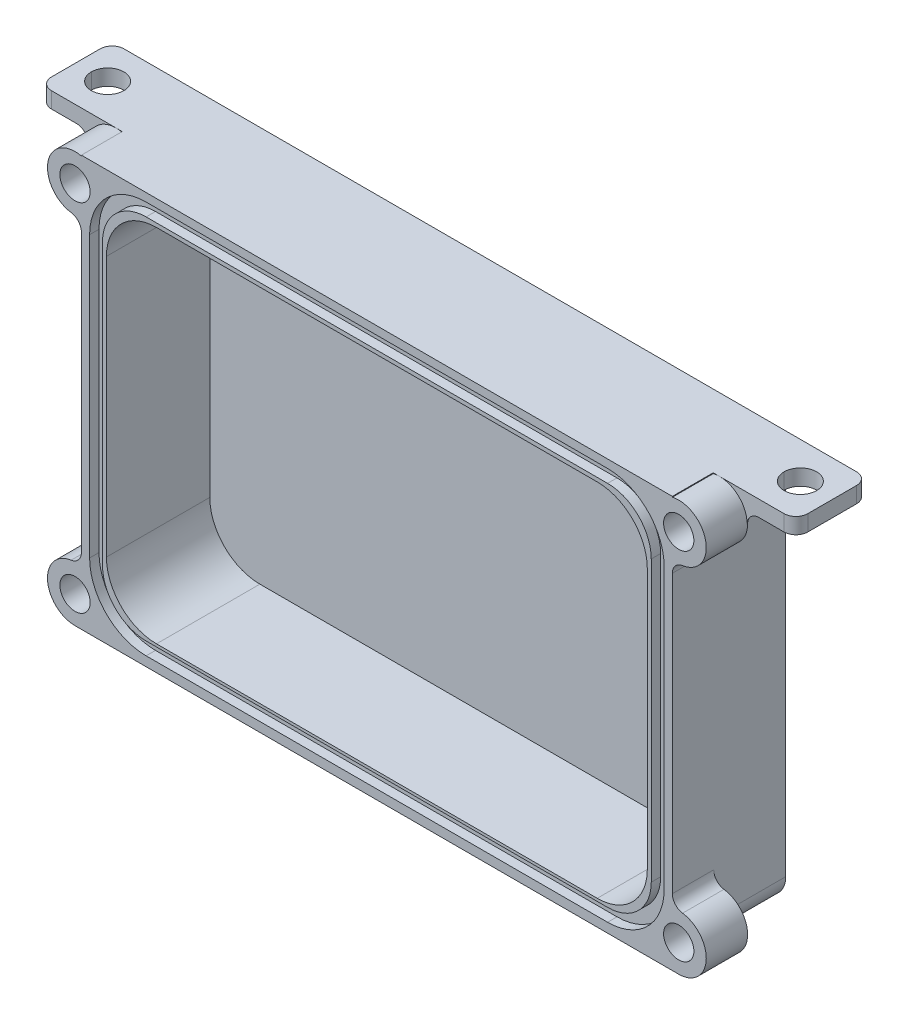
from build123d import *
from build123d.topology import SkipClean

# Parameters (mm, degrees)
SKETCH2_W           = 108
SKETCH2_H           = 72
BOSS_EXTRUDE1_DEPTH = 20.64
SHELL1_T            = 5
SKETCH3_W           = 118
SKETCH3_H           = 82
CUT_EXTRUDE1_DEPTH  = 3
FILLET1_R           = 10
SKETCH13_W          = 16.51
SKETCH13_H          = 14.478
SKETCH13_R          = 3.249999977
BOSS_EXTRUDE4_DEPTH = 3.175
BOSS_EXTRUDE2_DEPTH = 8.255
CUT_EXTRUDE4_DEPTH  = 6.35
CUT_EXTRUDE2_DEPTH  = 1.875
FILLET3_R           = 2.38
FILLET4_R           = 4.92
FILLET5_R           = 2.38


with BuildPart() as part:
    # Sketch2 → Boss-Extrude1 (new body)
    with BuildSketch(Plane.XY):
        Rectangle(SKETCH2_W, SKETCH2_H)
    extrude(amount=BOSS_EXTRUDE1_DEPTH)

    # Shell1
    shell1_openings = [part.faces().sort_by_distance(p)[0] for p in [
        (0, 0, 20.64),
    ]]
    offset(amount=SHELL1_T, openings=shell1_openings, kind=Kind.INTERSECTION)

    # Sketch3 → Cut-Extrude1 (cut)
    with BuildSketch(Plane(origin=(0, 0, -5), x_dir=(-1, 0, 0), z_dir=(0, 0, -1))):
        Rectangle(SKETCH3_W, SKETCH3_H)
    extrude(amount=-CUT_EXTRUDE1_DEPTH, mode=Mode.SUBTRACT)

    # Fillet1
    fillet1_edges = [part.edges().sort_by_distance(p)[0] for p in [
        (54, -36, 10.32),
        (54, 36, 10.32),
        (-54, 36, 10.32),
        (-54, -36, 10.32),
    ]]
    fillet(fillet1_edges, radius=FILLET1_R)

    # Sketch13 → Boss-Extrude4 (add)
    with BuildSketch(Plane(origin=(0, 41, 0), x_dir=(1, 0, 0), z_dir=(0, 1, 0))):
        with Locations((-67.255, -5.239)):
            Rectangle(SKETCH13_W, SKETCH13_H)
        with Locations((-69.16, -5.239)):
            Circle(SKETCH13_R, mode=Mode.SUBTRACT)
    boss_extrude4 = extrude(amount=-BOSS_EXTRUDE4_DEPTH)

    # Mirror4: Boss-Extrude4 across plane
    add(boss_extrude4.mirror(Plane(origin=(0, 0, 0), x_dir=(0, 0, 1), z_dir=(1, 0, 0))))

    # Sketch6 → Boss-Extrude2 (add)
    with BuildSketch(Plane.XY.offset(20.64)):
        with BuildLine():
            Line((59, -41), (60.27, -41))
            ThreePointArc((60.27, -41), (65.732714697, -34.86066586), (59, -30.148635688))
            Line((59, -30.148635688), (59, -41))
        make_face()
        with BuildLine():
            ThreePointArc((59, 30.148635688), (65.77, 35.5), (59, 40.851364312))
            Line((59, 40.851364312), (59, 30.148635688))
        make_face()
        with BuildLine():
            ThreePointArc((-59, -30.148635688), (-65.77, -35.5), (-59, -40.851364312))
            Line((-59, -40.851364312), (-59, -30.148635688))
        make_face()
        with BuildLine():
            ThreePointArc((-59, 40.851364312), (-65.77, 35.5), (-59, 30.148635688))
            Line((-59, 30.148635688), (-59, 40.851364312))
        make_face()
    boss_extrude2 = extrude(amount=-BOSS_EXTRUDE2_DEPTH)

    # Sketch6<4> → Cut-Extrude4 (cut)
    with BuildSketch(Plane.XY.offset(20.64)):
        with BuildLine():
            Line((59, 38.245491759), (59, 32.754508241))
            ThreePointArc((59, 32.754508241), (61.899244457, 32.951238046), (63.295, 35.5))
            ThreePointArc((63.295, 35.5), (61.899244457, 38.048761954), (59, 38.245491759))
        make_face()
        with BuildLine():
            ThreePointArc((59, 38.245491759), (57.245, 35.5), (59, 32.754508241))
            Line((59, 32.754508241), (59, 38.245491759))
        make_face()
        with BuildLine():
            Line((59, -38.245491759), (59, -32.754508241))
            ThreePointArc((59, -32.754508241), (57.245, -35.5), (59, -38.245491759))
        make_face()
        with BuildLine():
            ThreePointArc((63.295, -35.5), (61.899244457, -32.951238046), (59, -32.754508241))
            Line((59, -32.754508241), (59, -38.245491759))
            ThreePointArc((59, -38.245491759), (61.899244457, -38.048761954), (63.295, -35.5))
        make_face()
        with BuildLine():
            ThreePointArc((-59, -38.245491759), (-57.721238046, -37.129244457), (-57.245, -35.5))
            ThreePointArc((-57.245, -35.5), (-57.721238046, -33.870755543), (-59, -32.754508241))
            Line((-59, -32.754508241), (-59, -38.245491759))
        make_face()
        with BuildLine():
            Line((-59, -38.245491759), (-59, -32.754508241))
            ThreePointArc((-59, -32.754508241), (-63.295, -35.5), (-59, -38.245491759))
        make_face()
        with BuildLine():
            Line((-59, 38.245491759), (-59, 32.754508241))
            ThreePointArc((-59, 32.754508241), (-57.721238046, 33.870755543), (-57.245, 35.5))
            ThreePointArc((-57.245, 35.5), (-57.721238046, 37.129244457), (-59, 38.245491759))
        make_face()
        with BuildLine():
            ThreePointArc((-59, 38.245491759), (-63.295, 35.5), (-59, 32.754508241))
            Line((-59, 32.754508241), (-59, 38.245491759))
        make_face()
    cut_extrude4 = extrude(amount=-CUT_EXTRUDE4_DEPTH, mode=Mode.SUBTRACT)

    # Mirror5: Boss-Extrude2, Cut-Extrude4 across plane
    with SkipClean():  # the faces are left unmerged after this step: merging them gives an invalid solid
        add(boss_extrude2.mirror(Plane(origin=(0, 0, 0), x_dir=(0, 0, 1), z_dir=(1, 0, 0))))
        add(cut_extrude4.mirror(Plane(origin=(0, 0, 0), x_dir=(0, 0, 1), z_dir=(1, 0, 0))), mode=Mode.SUBTRACT)

    # Sketch5 → Cut-Extrude2 (cut)
    with SkipClean():  # the faces are left unmerged after this step: merging them gives an invalid solid
        with BuildSketch(Plane.XY.offset(20.64)):
            with BuildLine():
                Line((46.071067812, -39.11), (-46.071067812, -39.11))
                ThreePointArc((-46.071067812, -39.11), (-54.050767838, -35.804700026), (-57.356067812, -27.825))
                Line((-57.356067812, -27.825), (-57.356067812, 28.071067812))
                ThreePointArc((-57.356067812, 28.071067812), (-54.050767838, 36.050767838), (-46.071067812, 39.356067812))
                Line((-46.071067812, 39.356067812), (46.071067812, 39.356067812))
                ThreePointArc((46.071067812, 39.356067812), (54.050767838, 36.050767838), (57.356067812, 28.071067812))
                Line((57.356067812, 28.071067812), (57.356067812, -27.825))
                ThreePointArc((57.356067812, -27.825), (54.050767838, -35.804700026), (46.071067812, -39.11))
            make_face()
            with BuildLine():
                Line((46.071067812, -36.54), (-46.071067812, -36.54))
                ThreePointArc((-46.071067812, -36.54), (-52.23350341, -33.987435598), (-54.786067812, -27.825))
                Line((-54.786067812, -27.825), (-54.786067812, 28.071067812))
                ThreePointArc((-54.786067812, 28.071067812), (-52.23350341, 34.23350341), (-46.071067812, 36.786067812))
                Line((-46.071067812, 36.786067812), (46.071067812, 36.786067812))
                ThreePointArc((46.071067812, 36.786067812), (52.23350341, 34.23350341), (54.786067812, 28.071067812))
                Line((54.786067812, 28.071067812), (54.786067812, -27.825))
                ThreePointArc((54.786067812, -27.825), (52.23350341, -33.987435598), (46.071067812, -36.54))
            make_face(mode=Mode.SUBTRACT)
        extrude(amount=-CUT_EXTRUDE2_DEPTH, mode=Mode.SUBTRACT)

    # Fillet3
    fillet3_edges = [part.edges().sort_by_distance(p)[0] for p in [
        (59, -30.148635688, 16.5125),
        (-65.254413205, 37.825, 12.4315),
        (-59, 30.148635688, 16.5125),
        (-59, -30.148635688, 16.5125),
        (65.254413205, 37.825, 12.4315),
        (59, 30.148635688, 16.5125),
    ]]
    fillet(fillet3_edges, radius=FILLET3_R)

    # Fillet4
    fillet4_edges = [part.edges().sort_by_distance(p)[0] for p in [
        (59, -41, 5.1925),
        (-59, -41, 5.1925),
        (-59, 37.825, 5.1925),
        (59, 37.825, 5.1925),
    ]]
    fillet(fillet4_edges, radius=FILLET4_R)

    # Fillet5
    fillet5_edges = [part.edges().sort_by_distance(p)[0] for p in [
        (-75.51, 39.4125, 12.478),
        (-75.51, 39.4125, -2),
        (75.51, 39.4125, -2),
        (75.51, 39.4125, 12.478),
    ]]
    fillet(fillet5_edges, radius=FILLET5_R)


solid = part.part
